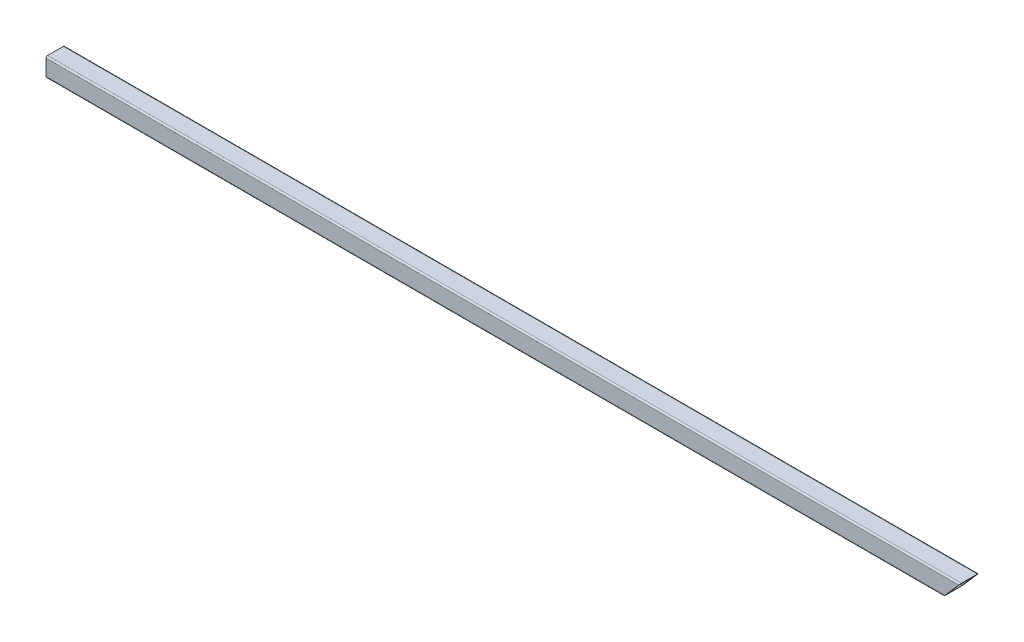
from build123d import *

# Parameters (mm, degrees)
SKETCH1_W           = 23.495
SKETCH1_H           = 23.495
BOSS_EXTRUDE1_DEPTH = 1320.8
SCALE4_SCALE_X      = 1
SCALE4_SCALE_Y      = 0.4
SCALE4_SCALE_Z      = 0.4
CUT_EXTRUDE2_DEPTH  = 1322.04802369


with BuildPart() as part:
    # Sketch1 → Boss-Extrude1 (new body)
    with BuildSketch(Plane(origin=(0, 0, 0), x_dir=(0, 0, -1), z_dir=(1, 0, 0))):
        with BuildLine():
            Line((0, 2.54), (0, 29.21))
            ThreePointArc((0, 29.21), (-0.743948776, 31.006051224), (-2.54, 31.75))
            Line((-2.54, 31.75), (-29.21, 31.75))
            ThreePointArc((-29.21, 31.75), (-31.006051224, 31.006051224), (-31.75, 29.21))
            Line((-31.75, 29.21), (-31.75, 2.54))
            ThreePointArc((-31.75, 2.54), (-31.006051224, 0.743948776), (-29.21, 0))
            Line((-29.21, 0), (-2.54, 0))
            ThreePointArc((-2.54, 0), (-0.743948776, 0.743948776), (0, 2.54))
        make_face()
        with Locations((-15.875, 15.875)):
            Rectangle(SKETCH1_W, SKETCH1_H, mode=Mode.SUBTRACT)
    extrude(amount=BOSS_EXTRUDE1_DEPTH)


with BuildPart() as part_1:
    # Scale4: scaled about (660.4, 15.875, 15.875)
    add(part.part.scale((SCALE4_SCALE_X, SCALE4_SCALE_Y, SCALE4_SCALE_Z), about=(660.4, 15.875, 15.875)))

    # Sketch8 → Cut-Extrude2 (cut, through all)
    with BuildSketch(Plane.XY.offset(22.225)):
        Polygon((616.511599643, 22.225), (605.47676407, 9.525), (644.192147645, 9.525), (655.226983218, 22.225), align=None)
    extrude(amount=-CUT_EXTRUDE2_DEPTH, mode=Mode.SUBTRACT)


with BuildPart() as body_2:
    # of the pieces the cut leaves, the one that is kept (cut_extrude2_keep)
    add(part_1.part.solids().sort_by_distance((0, 10.541, 9.525))[0])


solid = body_2.part
